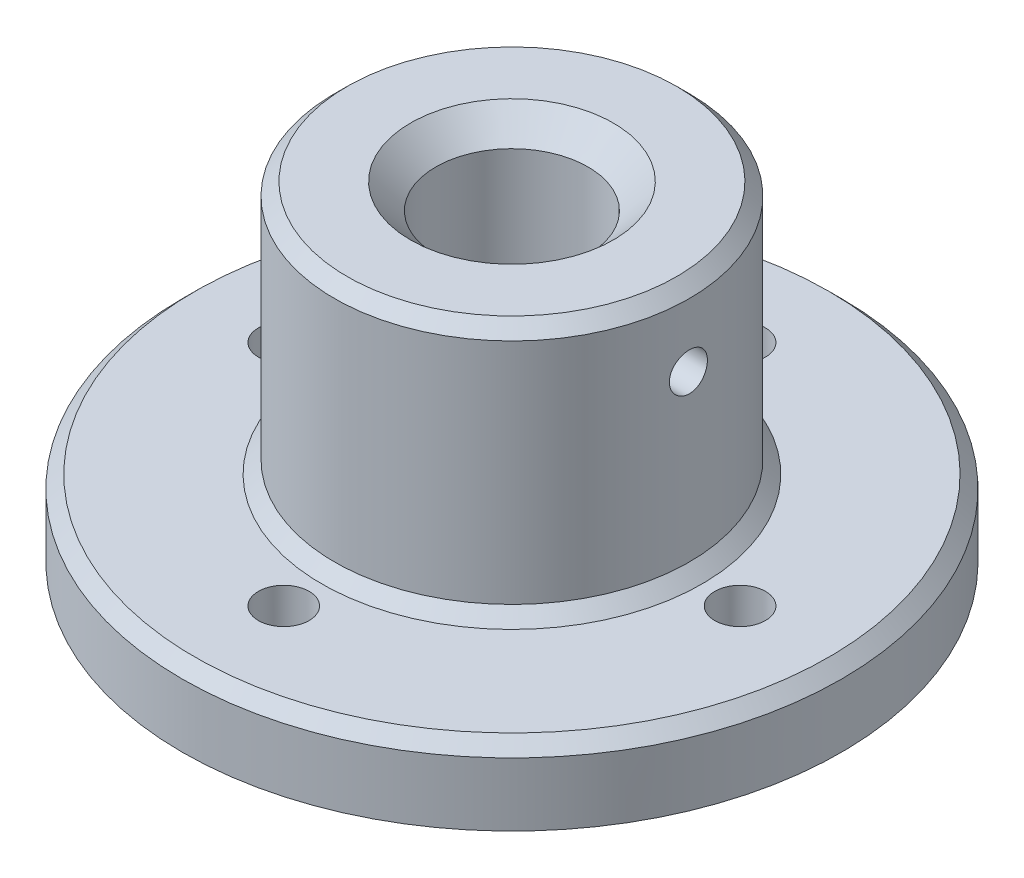
from build123d import *

# Parameters (mm, degrees)
CHAMFER1_SIZE      = 3.175
CHAMFER2_SIZE      = 1.5875
SKETCH2_R          = 3.175
CUT_EXTRUDE2_DEPTH = 72.490397082
CIRPATTERN2_COUNT  = 4
SKETCH3_R          = 2.38125
CUT_EXTRUDE3_DEPTH = 72.490397082


with BuildPart() as part:
    # Sketch1 → Revolve1 (revolve)
    with BuildSketch(Plane.XY, mode=Mode.PRIVATE) as revolve1_sk:
        Polygon((34.925, 0), (34.925, 3.175), (12.7, 3.175), (12.7, 12.7), (9.525, 12.7), (9.525, 41.275), (22.225, 41.275), (22.225, 9.525), (41.275, 9.525), (41.275, 0), align=None)
    revolve(revolve1_sk.sketch.rotate(Axis((0, 48.361075519, 0), (0, -1, 0)), 90), axis=Axis((0, 48.361075519, 0), (0, -1, 0)))

    # Chamfer1
    chamfer1_edges = [part.edges().sort_by_distance(p)[0] for p in [
        (0, 41.275, -9.525),
    ]]
    chamfer(chamfer1_edges, length=CHAMFER1_SIZE)

    # Chamfer2
    chamfer2_edges = [part.edges().sort_by_distance(p)[0] for p in [
        (0, 9.525, -41.275),
        (0, 9.525, -22.225),
        (0, 41.275, -22.225),
    ]]
    chamfer(chamfer2_edges, length=CHAMFER2_SIZE)

    # Sketch2 → Cut-Extrude2 (cut, through all)
    with BuildSketch(Plane(origin=(0, 41.275, 0), x_dir=(1, 0, 0), z_dir=(0, 1, 0))):
        with Locations(Location((28.575, 0, 0), (0, 0, 270))):
            Circle(SKETCH2_R)
    cut_extrude2 = extrude(amount=-CUT_EXTRUDE2_DEPTH, mode=Mode.SUBTRACT)

    # CirPattern2: Cut-Extrude2 ×4 about axis
    cirpattern2_axis = Axis((0, 0, 0), (0, 1, 0))
    for i in range(1, CIRPATTERN2_COUNT):
        add(cut_extrude2.rotate(cirpattern2_axis, i * 360 / CIRPATTERN2_COUNT), mode=Mode.SUBTRACT)

    # Sketch3 → Cut-Extrude3 (cut, through all)
    with BuildSketch(Plane(origin=(0, 0, 0), x_dir=(0, 0, -1), z_dir=(1, 0, 0))):
        with Locations(Location((0, 31.75, 0), (0, 0, 180))):
            Circle(SKETCH3_R)
    extrude(amount=CUT_EXTRUDE3_DEPTH, mode=Mode.SUBTRACT)


solid = part.part
